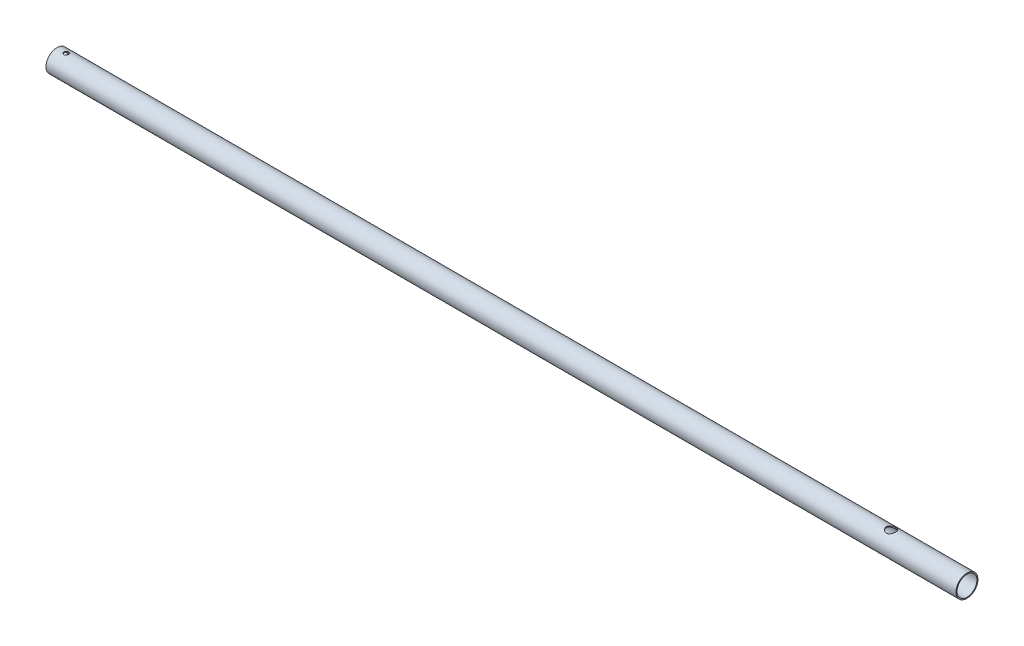
from build123d import *

# Parameters (mm, degrees)
SKETCH3_R           = 14.7701
SKETCH3_R_2         = 13.3223
BOSS_EXTRUDE1_DEPTH = 1219.2
SKETCH6_R           = 6.35
SKETCH6_R_2         = 3.175
CUT_EXTRUDE2_DEPTH  = 1220.647251983


with BuildPart() as part:
    # Sketch3 → Boss-Extrude1 (new body)
    with BuildSketch(Plane(origin=(0, 0, 0), x_dir=(0, 0, -1), z_dir=(1, 0, 0))):
        with Locations(Location((0, 0, 0), (0, 0, 180))):
            Circle(SKETCH3_R)
        with Locations(Location((0, 0, 0), (0, 0, 180))):
            Circle(SKETCH3_R_2, mode=Mode.SUBTRACT)
    extrude(amount=BOSS_EXTRUDE1_DEPTH)

    # Sketch6 → Cut-Extrude2 (cut, through all)
    with BuildSketch(Plane(origin=(0, -14.7701, 0), x_dir=(-1, 0, 0), z_dir=(0, -1, 0))):
        with Locations(Location((-1117.6, 0, 0), (0, 0, 90))):
            Circle(SKETCH6_R)
        with Locations(Location((-12.7, 0, 0), (0, 0, 90))):
            Circle(SKETCH6_R_2)
    extrude(amount=-CUT_EXTRUDE2_DEPTH, mode=Mode.SUBTRACT)


solid = part.part
